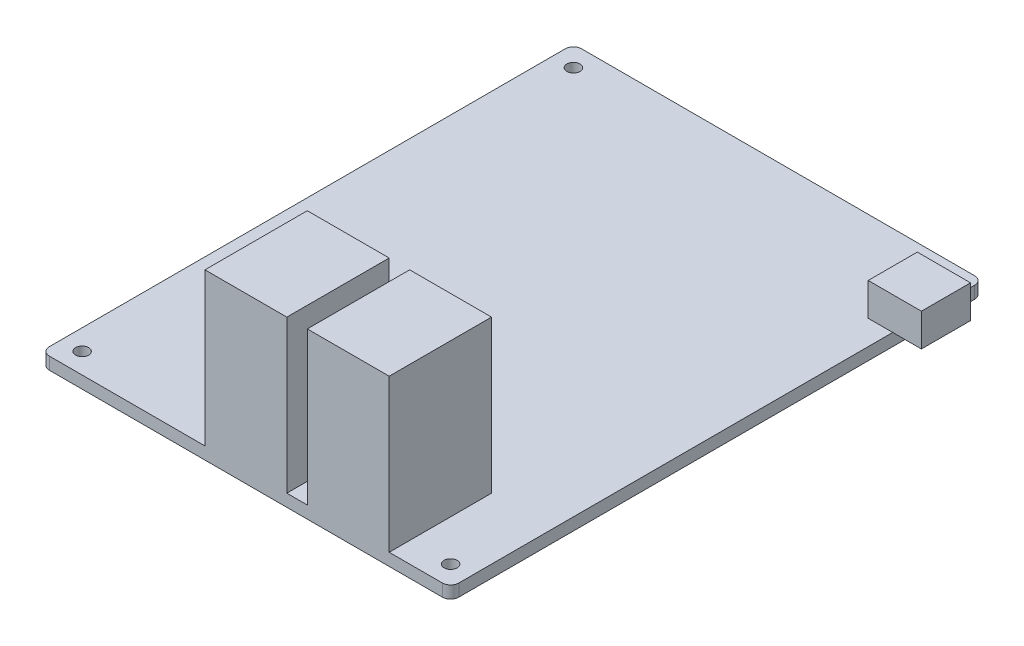
from build123d import *

# Parameters (mm, degrees)
SKETCH_1_W          = 100
SKETCH_1_H          = 130
EXTRUDE_1_DEPTH     = 3
SKETCH_2_W          = 20
SKETCH_2_H          = 25
EXTRUDE_2_DEPTH     = 37.25
FILLET_1_R          = 2
SKETCH_3_W          = 13
SKETCH_3_H          = 12
EXTRUDE_3_DEPTH     = 8
SKETCH_4_R          = 1.6
CUT_EXTRUDE_1_DEPTH = 95.135872546


with BuildPart() as part:
    # 草图1 → 凸台-拉伸1 (new body)
    with BuildSketch(Plane(origin=(0, 0, 0), x_dir=(1, 0, 0), z_dir=(0, 1, 0))):
        Rectangle(SKETCH_1_W, SKETCH_1_H)
    extrude(amount=EXTRUDE_1_DEPTH)

    # 草图2 → 凸台-拉伸2 (add)
    with BuildSketch(Plane(origin=(0, 3, 0), x_dir=(1, 0, 0), z_dir=(0, 1, 0))):
        with Locations((0, -52.5)):
            Rectangle(SKETCH_2_W, SKETCH_2_H)
        with Locations((25, -52.5)):
            Rectangle(SKETCH_2_W, SKETCH_2_H)
    extrude(amount=EXTRUDE_2_DEPTH)

    # 圆角1
    fillet_1_edges = [part.edges().sort_by_distance(p)[0] for p in [
        (-50, 1.5, 65),
        (-50, 1.5, -65),
        (50, 1.5, -65),
        (50, 1.5, 65),
    ]]
    fillet(fillet_1_edges, radius=FILLET_1_R)

    # 草图3 → 凸台-拉伸3 (add)
    with BuildSketch(Plane(origin=(0, 3, 0), x_dir=(1, 0, 0), z_dir=(0, 1, 0))):
        with Locations((50.5, 49)):
            Rectangle(SKETCH_3_W, SKETCH_3_H)
    extrude(amount=EXTRUDE_3_DEPTH)

    # 草图4 → 切除-拉伸1 (cut, through all)
    with BuildSketch(Plane(origin=(0, 3, 0), x_dir=(1, 0, 0), z_dir=(0, 1, 0))):
        with Locations(Location((-45, -60, 0), (0, 0, 270))):
            Circle(SKETCH_4_R)
        with Locations(Location((-45, 60, 0), (0, 0, 90))):
            Circle(SKETCH_4_R)
        with Locations(Location((45, 60, 0), (0, 0, 270))):
            Circle(SKETCH_4_R)
        with Locations(Location((45, -60, 0), (0, 0, 90))):
            Circle(SKETCH_4_R)
    extrude(amount=-CUT_EXTRUDE_1_DEPTH, mode=Mode.SUBTRACT)


solid = part.part
